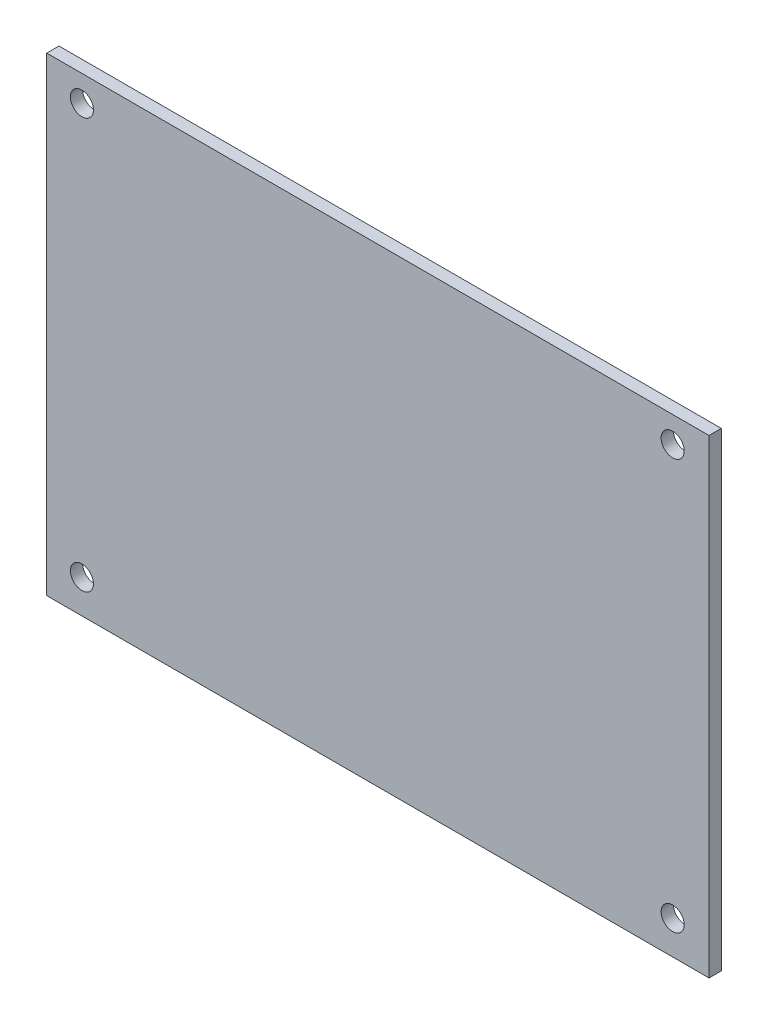
from build123d import *

# Parameters (mm, degrees)
SZKIC1_W                    = 91.76
SZKIC1_H                    = 65.1
DODANIE_WYCI_GNI_CIE1_DEPTH = 1.7
OTW_R_3_2_3_2_1_D           = 3.2
OTW_R_3_2_3_2_1_DEPTH       = 6
OTW_R_3_2_3_2_1_TIP         = 0.96137699


with BuildPart() as part:
    # Szkic1 → Dodanie-wyciągnięcie1 (new body)
    with BuildSketch(Plane.XY):
        Rectangle(SZKIC1_W, SZKIC1_H)
    extrude(amount=DODANIE_WYCI_GNI_CIE1_DEPTH)

    # Otwór Ø3.2 (3.2)1
    with Locations(Plane.XY.offset(1.7)):
        with Locations((-41.005, 28.945), (40.845, 28.945), (40.845, -27.905), (-41.005, -27.905)):
            Hole(OTW_R_3_2_3_2_1_D / 2, depth=OTW_R_3_2_3_2_1_DEPTH)
            with Locations((0, 0, -(OTW_R_3_2_3_2_1_DEPTH + OTW_R_3_2_3_2_1_TIP / 2))):  # 118° drill point
                Cone(0, OTW_R_3_2_3_2_1_D / 2, OTW_R_3_2_3_2_1_TIP, mode=Mode.SUBTRACT)


solid = part.part
